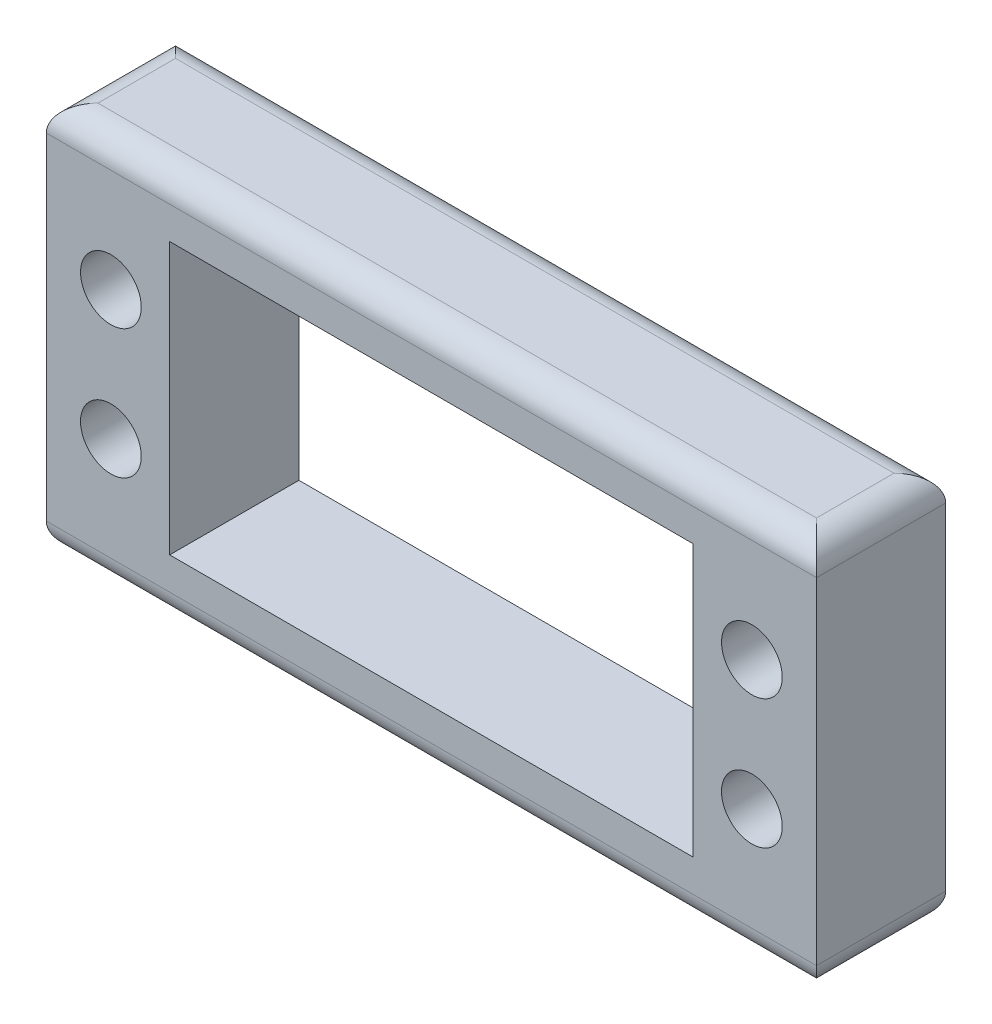
from build123d import *

# Parameters (mm, degrees)
SKETCH1_W           = 59.6
SKETCH1_H           = 30
SKETCH1_R           = 2.35
SKETCH1_W_2         = 40.5
SKETCH1_H_2         = 21
BOSS_EXTRUDE1_DEPTH = 10
FILLET1_R           = 2


with BuildPart() as part:
    # Sketch1 → Boss-Extrude1 (new body)
    with BuildSketch(Plane.XY):
        Rectangle(SKETCH1_W, SKETCH1_H)
        with Locations((-24.8, 5)):
            Circle(SKETCH1_R, mode=Mode.SUBTRACT)
        with Locations((24.8, 5)):
            Circle(SKETCH1_R, mode=Mode.SUBTRACT)
        with Locations(Location((24.8, -5, 0), (0, 0, 180))):
            Circle(SKETCH1_R, mode=Mode.SUBTRACT)
        with Locations(Location((-24.8, -5, 0), (0, 0, 180))):
            Circle(SKETCH1_R, mode=Mode.SUBTRACT)
        Rectangle(SKETCH1_W_2, SKETCH1_H_2, mode=Mode.SUBTRACT)
    extrude(amount=BOSS_EXTRUDE1_DEPTH)

    # Fillet1
    fillet1_edges = [part.edges().sort_by_distance(p)[0] for p in [
        (0, 15, 10),
        (0, 15, 0),
        (0, -15, 0),
        (-29.8, 15, 5),
        (29.8, 15, 5),
        (29.8, -15, 5),
        (-29.8, -15, 5),
        (0, -15, 10),
    ]]
    fillet(fillet1_edges, radius=FILLET1_R)


solid = part.part
